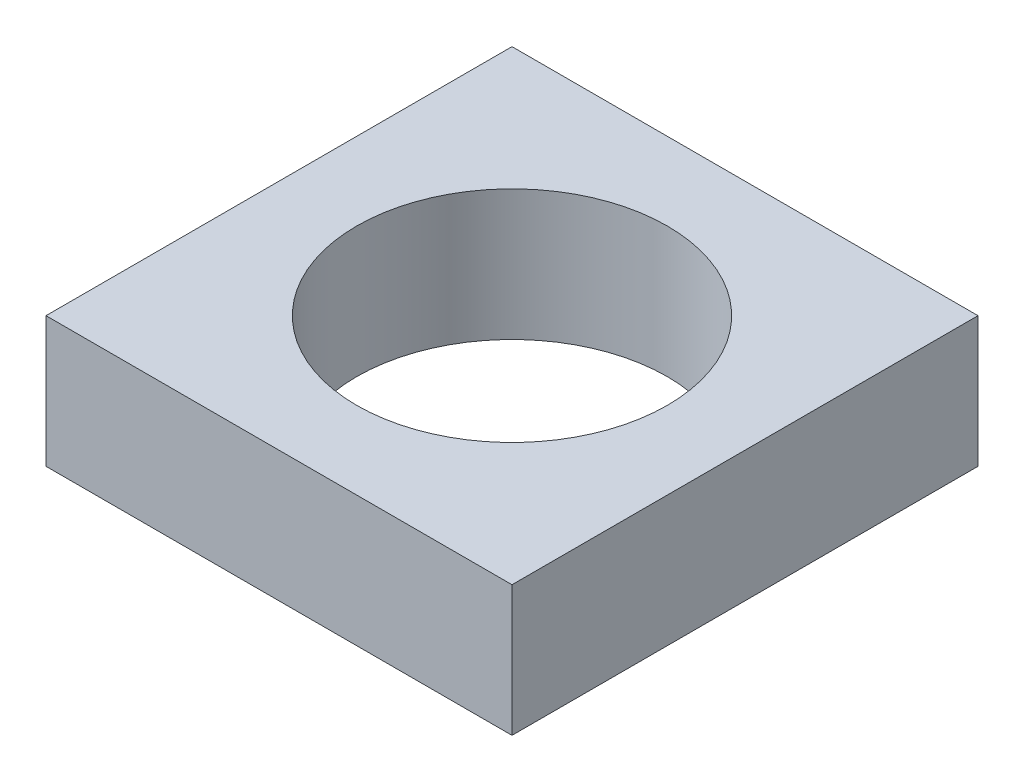
from build123d import *

# Parameters (mm, degrees)
SKETCH1_W           = 38.1
SKETCH1_H           = 38.1
BOSS_EXTRUDE1_DEPTH = 10.668
SKETCH3_R           = 12.7
CUT_EXTRUDE1_DEPTH  = 10.668


with BuildPart() as part:
    # Sketch1 → Boss-Extrude1 (new body)
    with BuildSketch(Plane(origin=(0, 0, 0), x_dir=(1, 0, 0), z_dir=(0, 1, 0))):
        Rectangle(SKETCH1_W, SKETCH1_H)
    extrude(amount=BOSS_EXTRUDE1_DEPTH)

    # Sketch3 → Cut-Extrude1 (cut)
    with BuildSketch(Plane(origin=(0, 10.668, 0), x_dir=(1, 0, 0), z_dir=(0, 1, 0))):
        with Locations(Location((0, 0, 0), (0, 0, 270))):
            Circle(SKETCH3_R)
    extrude(amount=-CUT_EXTRUDE1_DEPTH, mode=Mode.SUBTRACT)


solid = part.part
